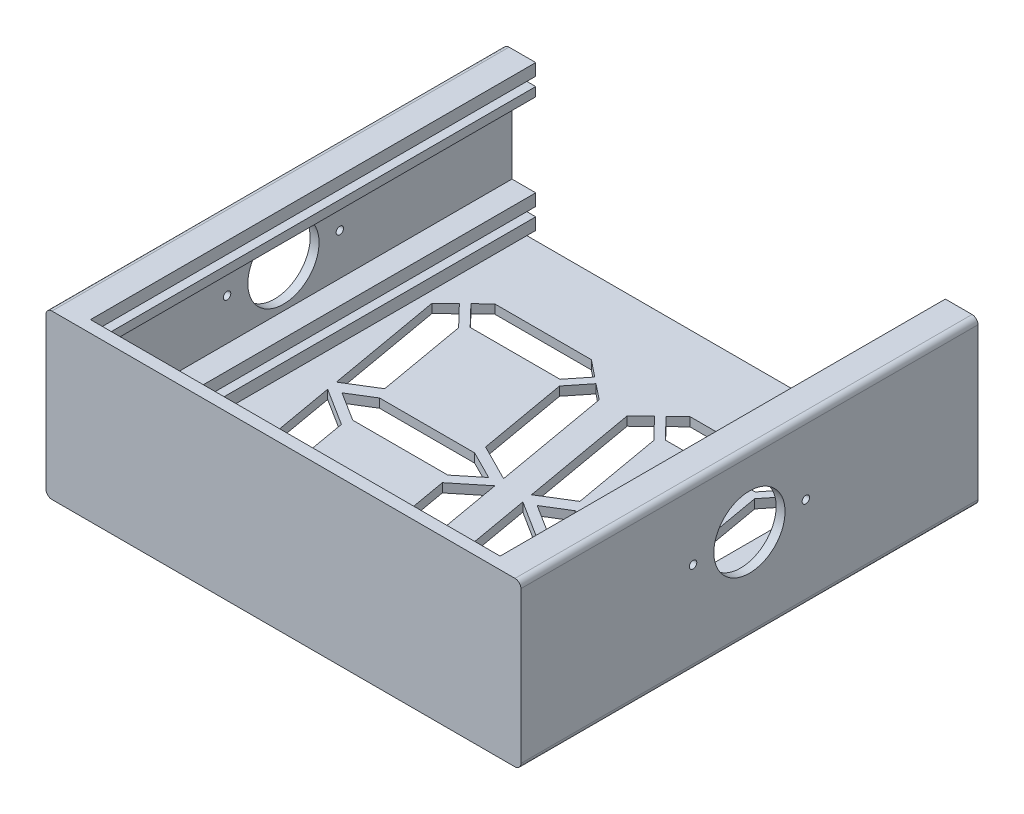
from build123d import *

# Parameters (mm, degrees)
BOSS_EXTRUDE4_DEPTH             = 154
BOSS_EXTRUDE5_REACH             = 216.516
SKETCH11_W                      = 4
SKETCH11_H                      = 7
BOSS_EXTRUDE5_DIRECTION_2_REACH = 216.516
BOSS_EXTRUDE6_DEPTH             = 45
SKETCH15_W                      = 138
SKETCH15_H                      = 4
SKETCH15_W_2                    = 154
BOSS_EXTRUDE7_DEPTH             = 8
SKETCH16_W                      = 150
SKETCH16_H                      = 3
SKETCH16_W_2                    = 142
SKETCH16_H_2                    = 4
BOSS_EXTRUDE8_DEPTH             = 8
CUT_EXTRUDE2_DEPTH              = 229.781555201
CUT_EXTRUDE2_DEPTH_BACK         = 229.781555201
SKETCH19_R                      = 12
SKETCH19_R_2                    = 1.25
CUT_EXTRUDE3_REACH              = 184.047
FILLET3_R                       = 2


with BuildPart() as part:
    # Sketch3 → Boss-Extrude4 (new body)
    with BuildSketch(Plane.XY):
        Polygon((-80, 0), (80, 0), (80, 10), (69, 10), (69, 6), (77, 6), (77, 3), (-77, 3), (-77, 6), (-69, 6), (-69, 10), (-80, 10), align=None)
    extrude(amount=BOSS_EXTRUDE4_DEPTH)

    # Sketch11 → Boss-Extrude5 (add, up to next)
    with BuildSketch(Plane(origin=(-69, 0, 0), x_dir=(0, 0, -1), z_dir=(1, 0, 0)), mode=Mode.PRIVATE) as boss_extrude5_sk1:
        with Locations((-152, 6.5)):
            Rectangle(SKETCH11_W, SKETCH11_H)
    boss_extrude5_tool1 = extrude(boss_extrude5_sk1.sketch, amount=BOSS_EXTRUDE5_REACH, mode=Mode.PRIVATE) - part.part
    add(boss_extrude5_tool1.solids().sort_by_distance((-69, 6.5, 152))[0])

    # Sketch11 → Boss-Extrude5 direction 2 (add, up to next)
    with BuildSketch(Plane(origin=(-69, 0, 0), x_dir=(0, 0, -1), z_dir=(1, 0, 0)), mode=Mode.PRIVATE) as boss_extrude5_direction_2_sk1:
        with Locations((-152, 6.5)):
            Rectangle(SKETCH11_W, SKETCH11_H)
    boss_extrude5_direction_2_tool1 = extrude(boss_extrude5_direction_2_sk1.sketch, amount=-BOSS_EXTRUDE5_DIRECTION_2_REACH, mode=Mode.PRIVATE) - part.part
    add(boss_extrude5_direction_2_tool1.solids().sort_by_distance((-69, 6.5, 152))[0])

    # Sketch13 → Boss-Extrude6 (add)
    with BuildSketch(Plane(origin=(0, 10, 0), x_dir=(1, 0, 0), z_dir=(0, 1, 0))):
        Polygon((80, 0), (77, 0), (77, -150), (-77, -150), (-77, 0), (-80, 0), (-80, -154), (80, -154), align=None)
    extrude(amount=BOSS_EXTRUDE6_DEPTH)

    # Sketch15 → Boss-Extrude7 (add)
    with BuildSketch(Plane(origin=(0, 0, 150), x_dir=(-1, 0, 0), z_dir=(0, 0, -1))):
        with Locations((0, 8)):
            Rectangle(SKETCH15_W, SKETCH15_H)
        with Locations((0, 15)):
            Rectangle(SKETCH15_W_2, SKETCH15_H)
    extrude(amount=BOSS_EXTRUDE7_DEPTH)

    # Sketch16 → Boss-Extrude8 (add)
    with BuildSketch(Plane(origin=(-77, 0, 0), x_dir=(0, 0, -1), z_dir=(1, 0, 0))):
        with Locations((-75, 46.5)):
            Rectangle(SKETCH16_W, SKETCH16_H)
        with Locations((-71, 15)):
            Rectangle(SKETCH16_W_2, SKETCH16_H_2)
        with Locations((-75, 53)):
            Rectangle(SKETCH16_W, SKETCH16_H_2)
    boss_extrude8 = extrude(amount=BOSS_EXTRUDE8_DEPTH)

    # Mirror1: Boss-Extrude8 across plane
    add(boss_extrude8.mirror(Plane(origin=(0, 0, 0), x_dir=(0, 0, 1), z_dir=(1, 0, 0))))

    # Sketch19 → Cut-Extrude2 (cut, two sides: drawn at the far end of the back side and taken through both)
    with BuildSketch(Plane(origin=(80, 0, 0), x_dir=(0, 0, -1), z_dir=(1, 0, 0)).offset(-CUT_EXTRUDE2_DEPTH_BACK)):
        with Locations(Location((-77, 31, 0), (0, 0, 180))):
            Circle(SKETCH19_R)
        with Locations(Location((-58, 31, 0), (0, 0, 180))):
            Circle(SKETCH19_R_2)
        with Locations(Location((-96, 31, 0), (0, 0, 180))):
            Circle(SKETCH19_R_2)
    extrude(amount=CUT_EXTRUDE2_DEPTH + CUT_EXTRUDE2_DEPTH_BACK, mode=Mode.SUBTRACT)

    # Sketch27 → Cut-Extrude3 (cut, up to next)
    with BuildSketch(Plane.XZ, mode=Mode.PRIVATE) as cut_extrude3_sk1:
        Polygon((-57.47846256, 25.321688373), (-24.93570827, 25.321688373), (-19.305381247, 29.819289123), (-24.499608086, 36.321688373), (-54.771412112, 36.321688373), (-61.574151377, 29.276341528), align=None)
    cut_extrude3_tool1 = extrude(cut_extrude3_sk1.sketch, amount=-CUT_EXTRUDE3_REACH, mode=Mode.PRIVATE) & part.part
    # Sketch27 → Cut-Extrude3 (cut, up to next)
    with BuildSketch(Plane.XZ, mode=Mode.PRIVATE) as cut_extrude3_sk2:
        Polygon((-56.617071459, 38.369250276), (-63.55245833, 31.186525183), (-68.252983819, 35.725187368), (-61.359608852, 74.819459497), (-51.28413594, 68.613830533), align=None)
    cut_extrude3_tool2 = extrude(cut_extrude3_sk2.sketch, amount=-CUT_EXTRUDE3_REACH, mode=Mode.PRIVATE) & part.part
    # Sketch27 → Cut-Extrude3 (cut, up to next)
    with BuildSketch(Plane.XZ, mode=Mode.PRIVATE) as cut_extrude3_sk3:
        Polygon((-22.615548373, 38.369250276), (-17.156752628, 31.535650116), (-11.912075272, 35.725187368), (-5.018700304, 74.819459497), (-17.282612854, 68.613830533), align=None)
    cut_extrude3_tool3 = extrude(cut_extrude3_sk3.sketch, amount=-CUT_EXTRUDE3_REACH, mode=Mode.PRIVATE) & part.part
    # Sketch27 → Cut-Extrude3 (cut, up to next)
    with BuildSketch(Plane.XZ, mode=Mode.PRIVATE) as cut_extrude3_sk4:
        Polygon((-57.266645874, 77), (-49.434486563, 72.176060211), (-17.400076182, 72.176060211), (-7.866735395, 77), (-15.460479394, 83.176060211), (-47.494889775, 83.176060211), align=None)
    cut_extrude3_tool4 = extrude(cut_extrude3_sk4.sketch, amount=-CUT_EXTRUDE3_REACH, mode=Mode.PRIVATE) & part.part
    # Sketch27 → Cut-Extrude3 (cut, up to next)
    with BuildSketch(Plane.XZ, mode=Mode.PRIVATE) as cut_extrude3_sk5:
        Polygon((-60.734283515, 78.365855711), (-53.840908548, 117.46012784), (-47.581510302, 123.087083774), (-42.646926869, 117.59787731), (-48.163667933, 86.310884009), align=None)
    cut_extrude3_tool5 = extrude(cut_extrude3_sk5.sketch, amount=-CUT_EXTRUDE3_REACH, mode=Mode.PRIVATE) & part.part
    # Sketch27 → Cut-Extrude3 (cut, up to next)
    with BuildSketch(Plane.XZ, mode=Mode.PRIVATE) as cut_extrude3_sk6:
        Polygon((-14.162144847, 86.310884009), (-4.393374967, 78.365855711), (2.5, 117.46012784), (-2.235185266, 123.038840685), (-8.645403783, 117.59787731), align=None)
    cut_extrude3_tool6 = extrude(cut_extrude3_sk6.sketch, amount=-CUT_EXTRUDE3_REACH, mode=Mode.PRIVATE) & part.part
    # Sketch27 → Cut-Extrude3 (cut, up to next)
    with BuildSketch(Plane.XZ, mode=Mode.PRIVATE) as cut_extrude3_sk7:
        Polygon((-45.536395336, 124.925562704), (-41.444496972, 120.373754987), (-9.624660978, 120.373754987), (-4.014751663, 125.13541967), (-9.309821385, 131.373754987), (-38.363457794, 131.373754987), align=None)
    cut_extrude3_tool7 = extrude(cut_extrude3_sk7.sketch, amount=-CUT_EXTRUDE3_REACH, mode=Mode.PRIVATE) & part.part
    # Sketch27 → Cut-Extrude3 (cut, up to next)
    with BuildSketch(Plane.XZ, mode=Mode.PRIVATE) as cut_extrude3_sk8:
        Polygon((8.274521259, 25.321688373), (40.817275549, 25.321688373), (46.447602573, 29.819289123), (41.253375733, 36.321688373), (10.981571707, 36.321688373), (4.178832443, 29.276341528), align=None)
    cut_extrude3_tool8 = extrude(cut_extrude3_sk8.sketch, amount=-CUT_EXTRUDE3_REACH, mode=Mode.PRIVATE) & part.part
    # Sketch27 → Cut-Extrude3 (cut, up to next)
    with BuildSketch(Plane.XZ, mode=Mode.PRIVATE) as cut_extrude3_sk9:
        Polygon((9.13591236, 38.369250276), (2.200525489, 31.186525183), (-2.5, 35.725187368), (4.393374967, 74.819459497), (14.46884788, 68.613830533), align=None)
    cut_extrude3_tool9 = extrude(cut_extrude3_sk9.sketch, amount=-CUT_EXTRUDE3_REACH, mode=Mode.PRIVATE) & part.part
    # Sketch27 → Cut-Extrude3 (cut, up to next)
    with BuildSketch(Plane.XZ, mode=Mode.PRIVATE) as cut_extrude3_sk10:
        Polygon((43.137435446, 38.369250276), (48.596231191, 31.535650116), (53.840908548, 35.725187368), (60.734283515, 74.819459497), (48.470370966, 68.613830533), align=None)
    cut_extrude3_tool10 = extrude(cut_extrude3_sk10.sketch, amount=-CUT_EXTRUDE3_REACH, mode=Mode.PRIVATE) & part.part
    # Sketch27 → Cut-Extrude3 (cut, up to next)
    with BuildSketch(Plane.XZ, mode=Mode.PRIVATE) as cut_extrude3_sk11:
        Polygon((8.486337945, 77), (16.318497257, 72.176060211), (48.352907637, 72.176060211), (57.886248425, 77), (50.292504425, 83.176060211), (18.258094045, 83.176060211), align=None)
    cut_extrude3_tool11 = extrude(cut_extrude3_sk11.sketch, amount=-CUT_EXTRUDE3_REACH, mode=Mode.PRIVATE) & part.part
    # Sketch27 → Cut-Extrude3 (cut, up to next)
    with BuildSketch(Plane.XZ, mode=Mode.PRIVATE) as cut_extrude3_sk12:
        Polygon((5.018700304, 78.365855711), (11.912075272, 117.46012784), (18.171473518, 123.087083774), (23.106056951, 117.59787731), (17.589315886, 86.310884009), align=None)
    cut_extrude3_tool12 = extrude(cut_extrude3_sk12.sketch, amount=-CUT_EXTRUDE3_REACH, mode=Mode.PRIVATE) & part.part
    # Sketch27 → Cut-Extrude3 (cut, up to next)
    with BuildSketch(Plane.XZ, mode=Mode.PRIVATE) as cut_extrude3_sk13:
        Polygon((51.590838973, 86.310884009), (61.359608852, 78.365855711), (68.252983819, 117.46012784), (63.517798554, 123.038840685), (57.107580037, 117.59787731), align=None)
    cut_extrude3_tool13 = extrude(cut_extrude3_sk13.sketch, amount=-CUT_EXTRUDE3_REACH, mode=Mode.PRIVATE) & part.part
    # Sketch27 → Cut-Extrude3 (cut, up to next)
    with BuildSketch(Plane.XZ, mode=Mode.PRIVATE) as cut_extrude3_sk14:
        Polygon((20.216588483, 124.925562704), (24.308486848, 120.373754987), (56.128322842, 120.373754987), (61.738232157, 125.13541967), (56.443162434, 131.373754987), (27.389526025, 131.373754987), align=None)
    cut_extrude3_tool14 = extrude(cut_extrude3_sk14.sketch, amount=-CUT_EXTRUDE3_REACH, mode=Mode.PRIVATE) & part.part
    add(cut_extrude3_tool1.solids().sort_by_distance((-40.338799, 0, 30.704471))[0], mode=Mode.SUBTRACT)
    add(cut_extrude3_tool2.solids().sort_by_distance((-59.857835, 0, 52.918339))[0], mode=Mode.SUBTRACT)
    add(cut_extrude3_tool3.solids().sort_by_distance((-14.193031, 0, 53.066237))[0], mode=Mode.SUBTRACT)
    add(cut_extrude3_tool4.solids().sort_by_distance((-32.455956, 0, 77.628005))[0], mode=Mode.SUBTRACT)
    add(cut_extrude3_tool5.solids().sort_by_distance((-51.306641, 0, 101.288791))[0], mode=Mode.SUBTRACT)
    add(cut_extrude3_tool6.solids().sort_by_distance((-5.750482, 0, 101.274794))[0], mode=Mode.SUBTRACT)
    add(cut_extrude3_tool7.solids().sort_by_distance((-24.675646, 0, 125.760601))[0], mode=Mode.SUBTRACT)
    add(cut_extrude3_tool8.solids().sort_by_distance((25.414185, 0, 30.704471))[0], mode=Mode.SUBTRACT)
    add(cut_extrude3_tool9.solids().sort_by_distance((5.895149, 0, 52.918339))[0], mode=Mode.SUBTRACT)
    add(cut_extrude3_tool10.solids().sort_by_distance((51.559953, 0, 53.066237))[0], mode=Mode.SUBTRACT)
    add(cut_extrude3_tool11.solids().sort_by_distance((33.297027, 0, 77.628005))[0], mode=Mode.SUBTRACT)
    add(cut_extrude3_tool12.solids().sort_by_distance((14.446343, 0, 101.288791))[0], mode=Mode.SUBTRACT)
    add(cut_extrude3_tool13.solids().sort_by_distance((60.002501, 0, 101.274794))[0], mode=Mode.SUBTRACT)
    add(cut_extrude3_tool14.solids().sort_by_distance((41.077338, 0, 125.760601))[0], mode=Mode.SUBTRACT)

    # Fillet3
    fillet3_edges = [part.edges().sort_by_distance(p)[0] for p in [
        (-80, 0, 77),
        (80, 0, 77),
        (80, 55, 77),
        (-80, 55, 77),
    ]]
    fillet(fillet3_edges, radius=FILLET3_R)


solid = part.part
